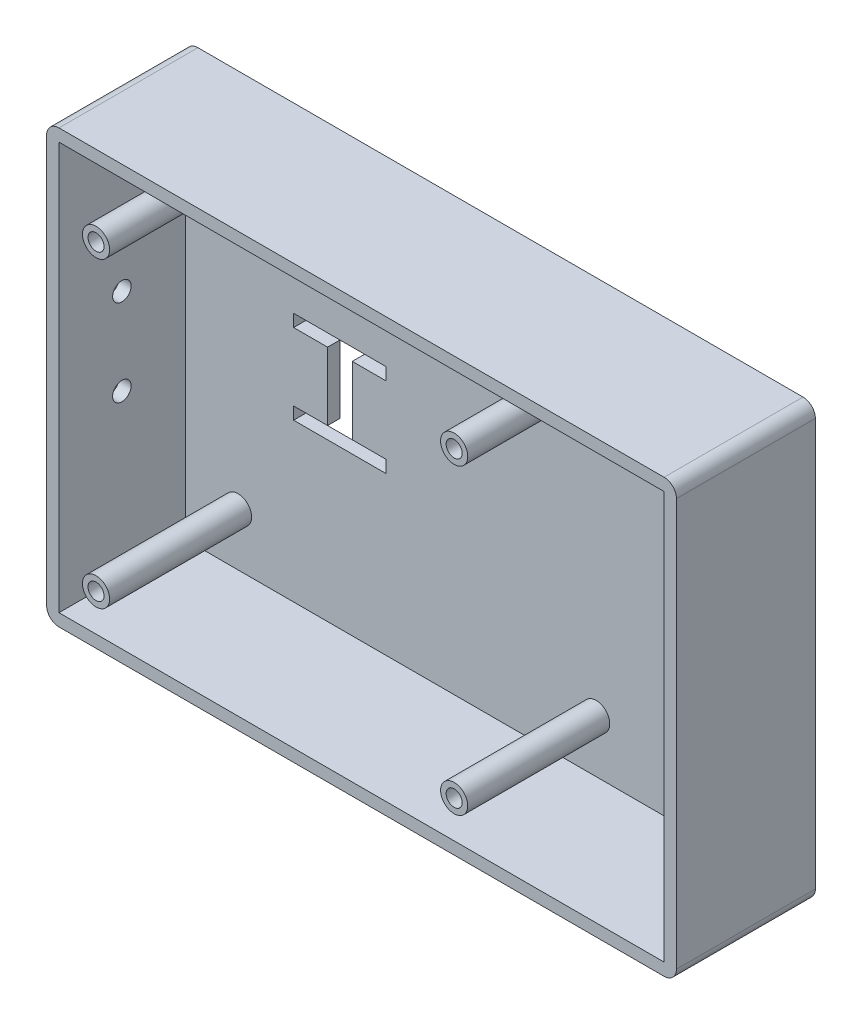
from build123d import *

# Parameters (mm, degrees)
BOSS_EXTRUDE1_DEPTH = 2
BOSS_EXTRUDE2_DEPTH = 22.5
SKETCH1_6_R         = 2.2
SKETCH1_6_R_2       = 1.3
BOSS_EXTRUDE3_DEPTH = 25
CUT_EXTRUDE1_DEPTH  = 25
SKETCH3_R           = 1.5
CUT_EXTRUDE2_DEPTH  = 25


with BuildPart() as part:
    # Sketch1 → Boss-Extrude1 (new body)
    with BuildSketch(Plane.XY):
        Polygon((-5, -5), (93, -5), (93, 0), (93, 56), (93, 61), (-5, 61), align=None)
    extrude(amount=BOSS_EXTRUDE1_DEPTH)

    # Sketch1<5> → Boss-Extrude2 (add)
    with BuildSketch(Plane.XY):
        with BuildLine():
            Line((93, 63), (-5, 63))
            ThreePointArc((-5, 63), (-6.414213562, 62.414213562), (-7, 61))
            Line((-7, 61), (-7, -5))
            ThreePointArc((-7, -5), (-6.414213562, -6.414213562), (-5, -7))
            Line((-5, -7), (93, -7))
            ThreePointArc((93, -7), (94.414213562, -6.414213562), (95, -5))
            Line((95, -5), (95, 0))
            Line((95, 0), (95, 56))
            Line((95, 56), (95, 61))
            ThreePointArc((95, 61), (94.414213562, 62.414213562), (93, 63))
        make_face()
        Polygon((93, -5), (-5, -5), (-5, 61), (93, 61), (93, 56), (93, 0), align=None, mode=Mode.SUBTRACT)
    extrude(amount=BOSS_EXTRUDE2_DEPTH)

    # Sketch1<6> → Boss-Extrude3 (add)
    # profile 1 of 4: a face of its own
    with BuildSketch(Plane.XY):
        with Locations((3.5, 52.5)):
            Circle(SKETCH1_6_R)
        with Locations((3.5, 52.5)):
            Circle(SKETCH1_6_R_2, mode=Mode.SUBTRACT)
    # profile 2 of 4: a face of its own
    with BuildSketch(Plane.XY):
        with Locations((61.5, 52.5)):
            Circle(SKETCH1_6_R)
        with Locations((61.5, 52.5)):
            Circle(SKETCH1_6_R_2, mode=Mode.SUBTRACT)
    # profile 3 of 4: a face of its own
    with BuildSketch(Plane.XY):
        with Locations((61.5, 3.5)):
            Circle(SKETCH1_6_R)
        with Locations((61.5, 3.5)):
            Circle(SKETCH1_6_R_2, mode=Mode.SUBTRACT)
    # profile 4 of 4: a face of its own
    with BuildSketch(Plane.XY):
        with Locations((3.5, 3.5)):
            Circle(SKETCH1_6_R)
        with Locations((3.5, 3.5)):
            Circle(SKETCH1_6_R_2, mode=Mode.SUBTRACT)
    extrude(amount=BOSS_EXTRUDE3_DEPTH)

    # Sketch2 → Cut-Extrude1 (cut)
    with BuildSketch(Plane(origin=(0, 0, 0), x_dir=(-1, 0, 0), z_dir=(0, 0, -1))):
        Polygon((-27.5, 20.5), (-20, 20.5), (-12.5, 20.5), (-12.5, 22.5), (-18, 22.5), (-18, 28), (-18, 33.5), (-12.5, 33.5), (-12.5, 35.5), (-20, 35.5), (-27.5, 35.5), (-27.5, 33.5), (-22, 33.5), (-22, 28), (-22, 22.5), (-27.5, 22.5), align=None)
    extrude(amount=-CUT_EXTRUDE1_DEPTH, mode=Mode.SUBTRACT)

    # Sketch3 → Cut-Extrude2 (cut)
    with BuildSketch(Plane.ZY.offset(7)):
        with Locations((12.31170847, 35)):
            Circle(SKETCH3_R)
        with Locations((12.31170847, 21)):
            Circle(SKETCH3_R)
    extrude(amount=-CUT_EXTRUDE2_DEPTH, mode=Mode.SUBTRACT)


solid = part.part
